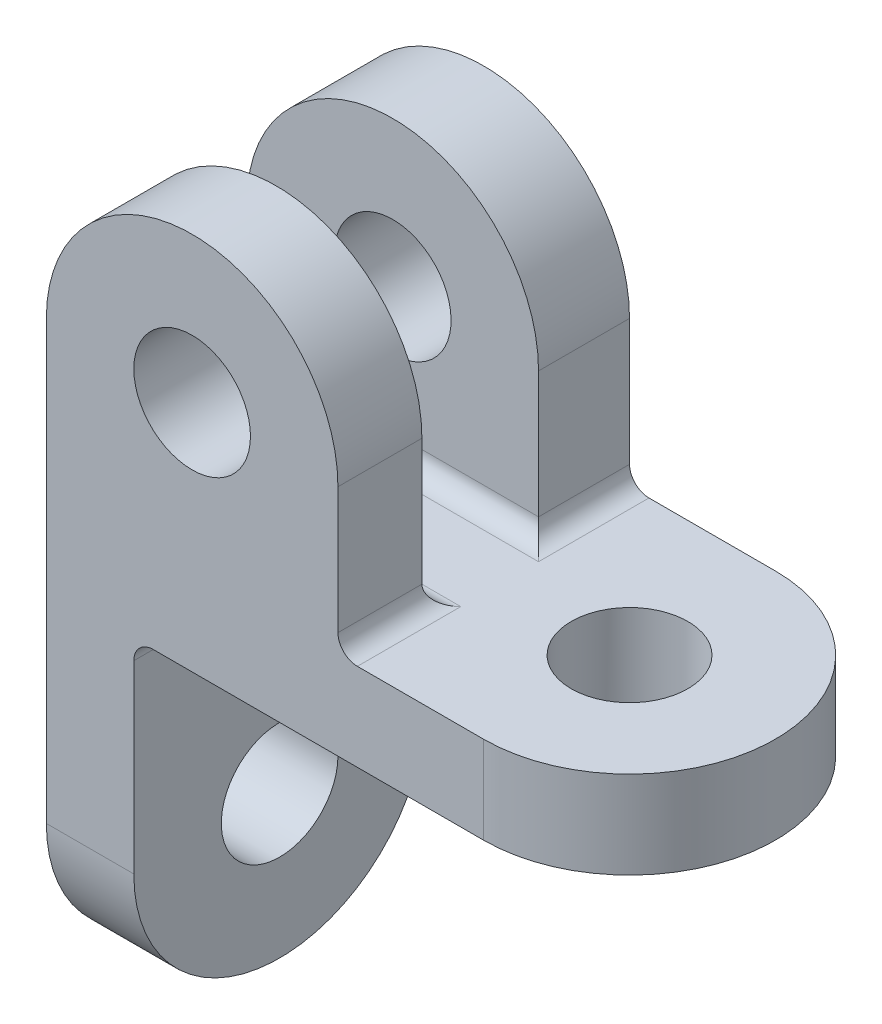
from build123d import *

# Parameters (mm, degrees)
SKETCH1_R                            = 6
BOSS_EXTRUDE1_DEPTH                  = 30
FILLET2_RADIUS                       = 15
FILLET2_LENGTH                       = 9
FILLET3_RADIUS                       = 15
FILLET3_LENGTH                       = 9
CUT_EXTRUDE1_DEPTH                   = 10
CUT_EXTRUDE1_DEPTH_BACK              = 59
SKETCH2_W                            = 12
SKETCH2_H                            = 40.970774173
F_12_0MM_DOWEL_HOLE1_D               = 12
F_12_0MM_DOWEL_HOLE1_DEPTH           = 10
F_12_0MM_DOWEL_HOLE1_TIP             = 3.605163714
F_12_0MM_DOWEL_HOLE1_ON_FACE_2_D     = 12
F_12_0MM_DOWEL_HOLE1_ON_FACE_2_DEPTH = 10
F_12_0MM_DOWEL_HOLE1_ON_FACE_2_TIP   = 3.605163714
FILLET4_R                            = 2


with BuildPart() as part:
    # Sketch1 → Boss-Extrude1 (new body)
    with BuildSketch(Plane.XY):
        with BuildLine():
            Line((15, 15), (15, 0))
            Line((15, 0), (45, 0))
            Line((45, 0), (45, -9))
            Line((45, -9), (7.15528467, -9))
            Line((7.15528467, -9), (-6, -9))
            Line((-6, -9), (-6, -45))
            Line((-6, -45), (-15, -45))
            Line((-15, -45), (-15, 15))
            ThreePointArc((-15, 15), (0, 30), (15, 15))
        make_face()
        with Locations((0, 15)):
            Circle(SKETCH1_R, mode=Mode.SUBTRACT)
    extrude(amount=BOSS_EXTRUDE1_DEPTH)

    # Fillet2: full round fillet: the end face becomes a half cylinder, R = half its width
    fillet2_face = Plane((45, -4.5, 15), x_dir=(0, 1, 0), z_dir=(1, 0, 0))  # on the end face: x along it, z out of the body
    fillet2_slab = fillet2_face.offset(-FILLET2_RADIUS / 2) * Box(FILLET2_LENGTH, 2 * FILLET2_RADIUS, FILLET2_RADIUS, mode=Mode.PRIVATE)  # the body's end, R deep
    fillet2_round = Plane((30, -4.5, 15), x_dir=(1, 0, 0), z_dir=(0, 1, 0)) * Cylinder(FILLET2_RADIUS, FILLET2_LENGTH, mode=Mode.PRIVATE)  # its axis R under the face
    add(fillet2_slab - fillet2_round, mode=Mode.SUBTRACT)

    # Fillet3: full round fillet: the end face becomes a half cylinder, R = half its width
    fillet3_face = Plane((-10.5, -45, 15), x_dir=(1, 0, 0), z_dir=(0, -1, 0))  # on the end face: x along it, z out of the body
    fillet3_slab = fillet3_face.offset(-FILLET3_RADIUS / 2) * Box(FILLET3_LENGTH, 2 * FILLET3_RADIUS, FILLET3_RADIUS, mode=Mode.PRIVATE)  # the body's end, R deep
    fillet3_round = Plane((-10.5, -30, 15), x_dir=(0, -1, 0), z_dir=(1, 0, 0)) * Cylinder(FILLET3_RADIUS, FILLET3_LENGTH, mode=Mode.PRIVATE)  # its axis R under the face
    add(fillet3_slab - fillet3_round, mode=Mode.SUBTRACT)

    # Sketch2 → Cut-Extrude1 (cut, two sides: drawn at the far end of the back side and taken through both)
    with BuildSketch(Plane(origin=(15, 0, 0), x_dir=(0, 0, -1), z_dir=(1, 0, 0)).offset(-CUT_EXTRUDE1_DEPTH_BACK)):
        with Locations((-15.359950539, 20.485387087)):
            Rectangle(SKETCH2_W, SKETCH2_H)
    extrude(amount=CUT_EXTRUDE1_DEPTH + CUT_EXTRUDE1_DEPTH_BACK, mode=Mode.SUBTRACT)

    # Ø12.0mm Dowel Hole1
    with Locations(Plane(origin=(30, 0, 15), x_dir=(1, 0, 0), z_dir=(0, 1, 0))):
        with Locations((0, 0)):
            Hole(F_12_0MM_DOWEL_HOLE1_D / 2, depth=F_12_0MM_DOWEL_HOLE1_DEPTH)
            with Locations((0, 0, -(F_12_0MM_DOWEL_HOLE1_DEPTH + F_12_0MM_DOWEL_HOLE1_TIP / 2))):  # 118° drill point
                Cone(0, F_12_0MM_DOWEL_HOLE1_D / 2, F_12_0MM_DOWEL_HOLE1_TIP, mode=Mode.SUBTRACT)

    # Ø12.0mm Dowel Hole1 on face 2
    with Locations(Plane(origin=(-6, -30, 15), x_dir=(0, 0, 1), z_dir=(1, 0, 0))):
        with Locations((0, 0)):
            Hole(F_12_0MM_DOWEL_HOLE1_ON_FACE_2_D / 2, depth=F_12_0MM_DOWEL_HOLE1_ON_FACE_2_DEPTH)
            with Locations((0, 0, -(F_12_0MM_DOWEL_HOLE1_ON_FACE_2_DEPTH + F_12_0MM_DOWEL_HOLE1_ON_FACE_2_TIP / 2))):  # 118° drill point
                Cone(0, F_12_0MM_DOWEL_HOLE1_ON_FACE_2_D / 2, F_12_0MM_DOWEL_HOLE1_ON_FACE_2_TIP, mode=Mode.SUBTRACT)

    # Fillet4
    fillet4_edges = [part.edges().sort_by_distance(p)[0] for p in [
        (15, 0, 25.67997527),
        (-6, -9, 15),
        (15, 0, 4.67997527),
        (0, 0, 21.359950539),
        (0, 0, 9.359950539),
    ]]
    fillet(fillet4_edges, radius=FILLET4_R)


solid = part.part
